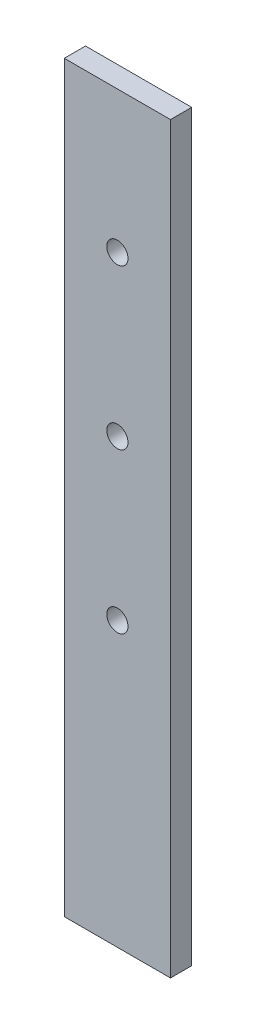
from build123d import *

# Parameters (mm, degrees)
SKETCH1_W           = 30
SKETCH1_H           = 210
BOSS_EXTRUDE1_DEPTH = 6
SKETCH2_R           = 3
CUT_EXTRUDE1_DEPTH  = 6


with BuildPart() as part:
    # Sketch1 → Boss-Extrude1 (new body)
    with BuildSketch(Plane.XY):
        with Locations((15, 105)):
            Rectangle(SKETCH1_W, SKETCH1_H)
    extrude(amount=BOSS_EXTRUDE1_DEPTH)

    # Sketch2 → Cut-Extrude1 (cut)
    with BuildSketch(Plane.XY.offset(6)):
        with Locations((15, 170)):
            Circle(SKETCH2_R)
        with Locations((15, 125)):
            Circle(SKETCH2_R)
        with Locations((15, 80)):
            Circle(SKETCH2_R)
    extrude(amount=-CUT_EXTRUDE1_DEPTH, mode=Mode.SUBTRACT)


solid = part.part
